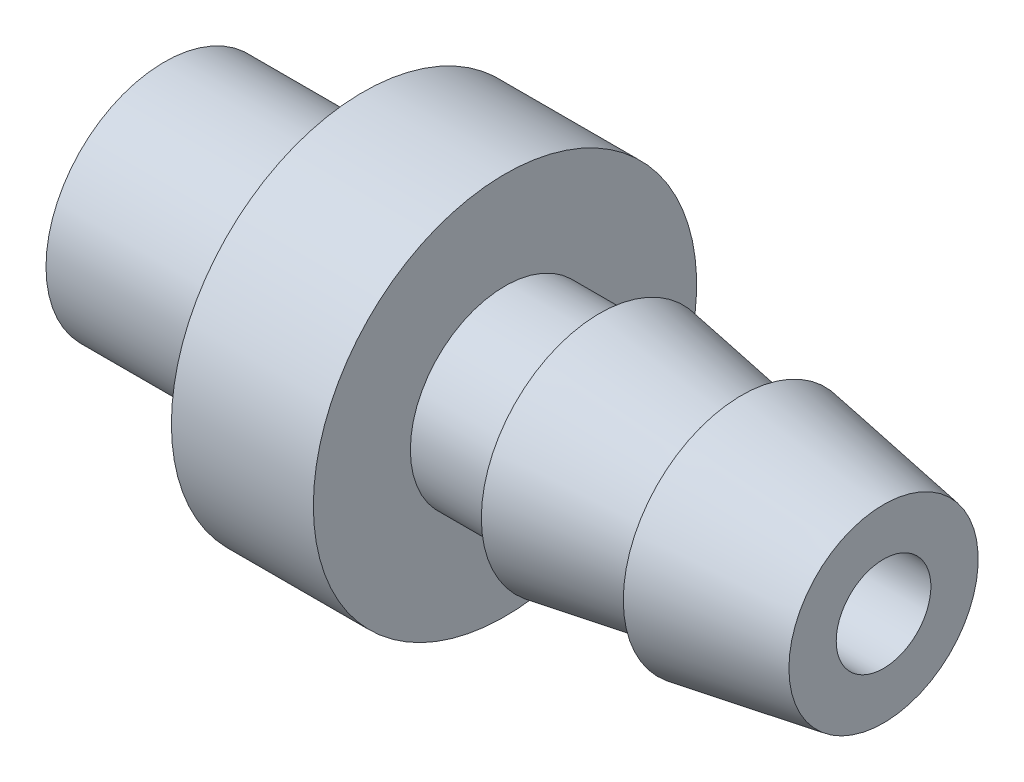
from build123d import *


with BuildPart() as part:
    # Esquisse4 → Révolution2 (revolve)
    with BuildSketch(Plane.XY, mode=Mode.PRIVATE) as r_volution2_sk:
        Polygon((0, 1), (-4.2, 1), (-4.2, 2.5), (0, 2.5), (0, 4.05), (3, 4.05), (3, 2), (5, 2), (5, 2.5), (8, 2), (8, 2.5), (11, 2), (11, 1), align=None)
    revolve(r_volution2_sk.sketch.rotate(Axis((0, 0, 0), (1, 0, 0)), 90), axis=Axis((0, 0, 0), (1, 0, 0)))


solid = part.part
